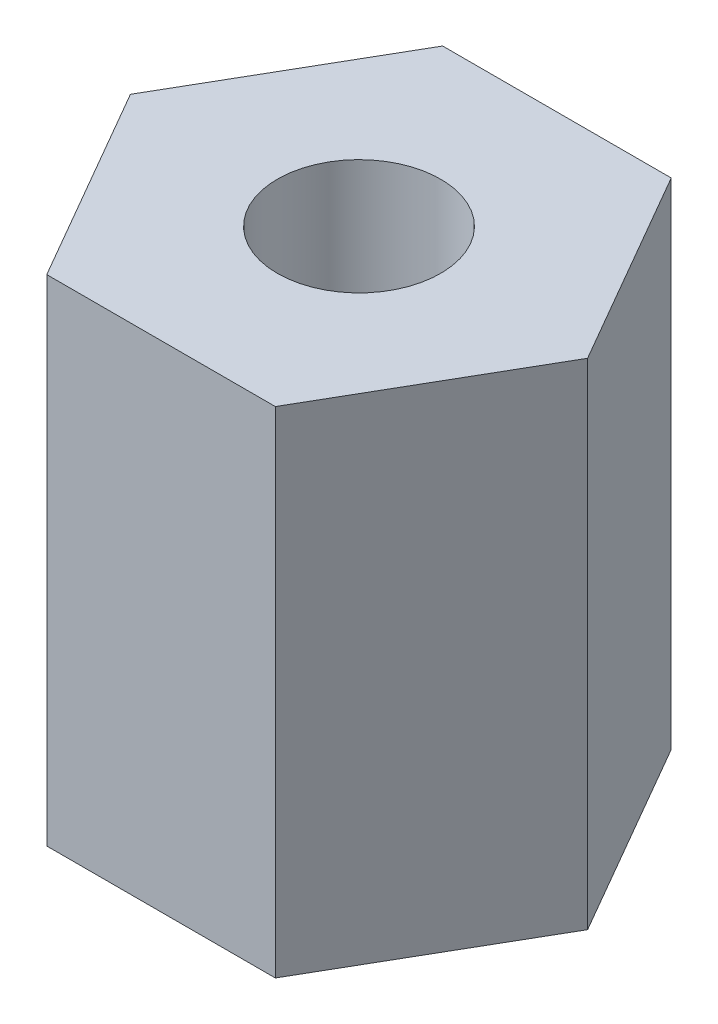
from build123d import *

# Parameters (mm, degrees)
EXTRUDE_1_DEPTH        = 10
HOLE_WIZARD_M4_1_D     = 3.3
HOLE_WIZARD_M4_1_DEPTH = 14.1
HOLE_WIZARD_M4_1_TIP   = 0.991420021


with BuildPart() as part:
    # 草图1 → 凸台-拉伸1 (new body)
    with BuildSketch(Plane(origin=(0, 0, 0), x_dir=(1, 0, 0), z_dir=(0, 1, 0))):
        Polygon((2.309401077, 4), (-2.309401077, 4), (-4.618802154, 0), (-2.309401077, -4), (2.309401077, -4), (4.618802154, 0), align=None)
    extrude(amount=EXTRUDE_1_DEPTH)

    # M4 螺纹孔1
    with Locations(Plane(origin=(0, 10, 0), x_dir=(1, 0, 0), z_dir=(0, 1, 0))):
        with Locations((0, 0)):
            Hole(HOLE_WIZARD_M4_1_D / 2, depth=HOLE_WIZARD_M4_1_DEPTH)
            with Locations((0, 0, -(HOLE_WIZARD_M4_1_DEPTH + HOLE_WIZARD_M4_1_TIP / 2))):  # 118° drill point
                Cone(0, HOLE_WIZARD_M4_1_D / 2, HOLE_WIZARD_M4_1_TIP, mode=Mode.SUBTRACT)


solid = part.part
